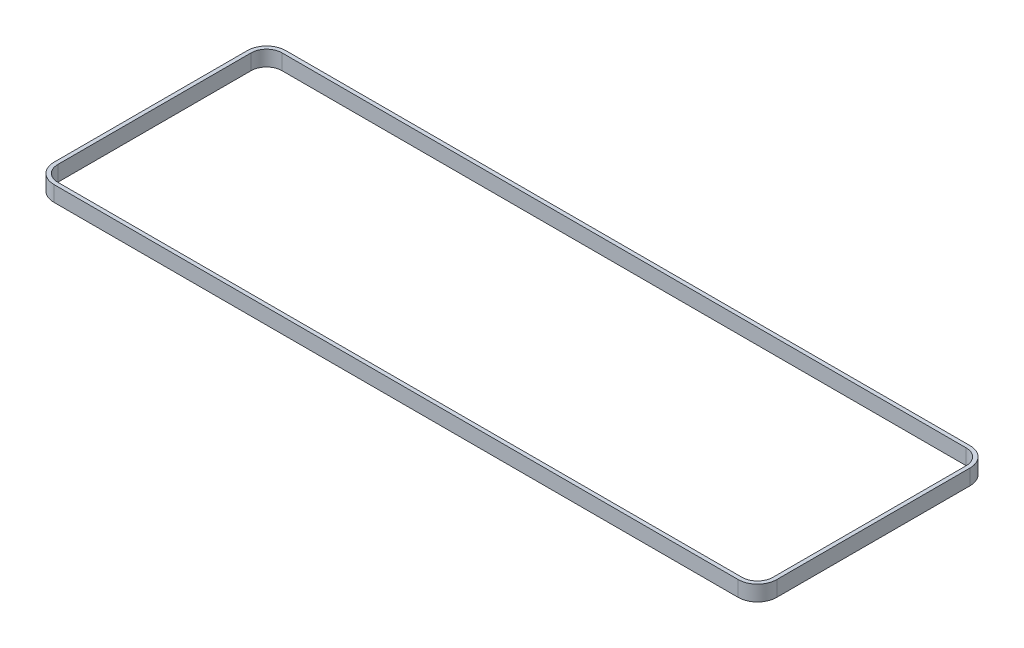
from build123d import *

# Parameters (mm, degrees)
BOSS_EXTRUDE1_DEPTH = 5.08


with BuildPart() as part:
    # Sketch1 → Boss-Extrude1 (new body)
    with BuildSketch(Plane(origin=(0, 0, 0), x_dir=(1, 0, 0), z_dir=(0, 1, 0))):
        with BuildLine():
            Line((-112.395, 38.1), (112.395, 38.1))
            ThreePointArc((112.395, 38.1), (116.885128061, 36.240128061), (118.745, 31.75))
            Line((118.745, 31.75), (118.745, -31.75))
            ThreePointArc((118.745, -31.75), (116.885128061, -36.240128061), (112.395, -38.1))
            Line((112.395, -38.1), (-112.395, -38.1))
            ThreePointArc((-112.395, -38.1), (-116.885128061, -36.240128061), (-118.745, -31.75))
            Line((-118.745, -31.75), (-118.745, 31.75))
            ThreePointArc((-118.745, 31.75), (-116.885128061, 36.240128061), (-112.395, 38.1))
        make_face()
        with BuildLine():
            Line((-112.395, -36.83), (112.395, -36.83))
            ThreePointArc((112.395, -36.83), (115.987102448, -35.342102448), (117.475, -31.75))
            Line((117.475, -31.75), (117.475, 31.75))
            ThreePointArc((117.475, 31.75), (115.987102448, 35.342102448), (112.395, 36.83))
            Line((112.395, 36.83), (-112.395, 36.83))
            ThreePointArc((-112.395, 36.83), (-115.987102448, 35.342102448), (-117.475, 31.75))
            Line((-117.475, 31.75), (-117.475, -31.75))
            ThreePointArc((-117.475, -31.75), (-115.987102448, -35.342102448), (-112.395, -36.83))
        make_face(mode=Mode.SUBTRACT)
    extrude(amount=BOSS_EXTRUDE1_DEPTH)


solid = part.part
